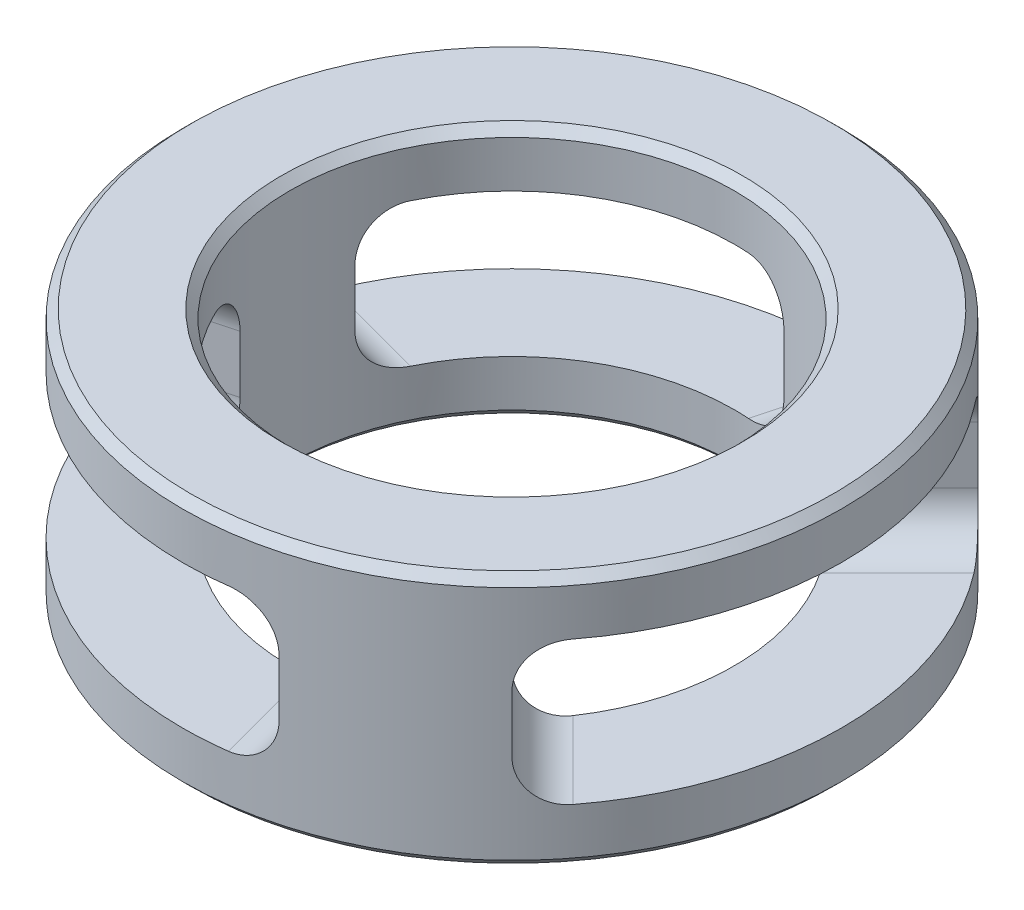
from build123d import *

# Parameters (mm, degrees)
SKETCH1_R           = 11.5
SKETCH1_R_2         = 7.75
BOSS_EXTRUDE1_DEPTH = 4.42
CUT_EXTRUDE1_DEPTH  = 2.5
FILLET1_R           = 1.5
CHAMFER1_SIZE       = 0.3


with BuildPart() as part:
    # Sketch1 → Boss-Extrude1 (new, symmetric)
    with BuildSketch(Plane(origin=(0, 0, 0), x_dir=(1, 0, 0), z_dir=(0, 1, 0))):
        with Locations(Location((0, 0, 0), (0, 0, 270))):
            Circle(SKETCH1_R)
        with Locations(Location((0, 0, 0), (0, 0, 270))):
            Circle(SKETCH1_R_2, mode=Mode.SUBTRACT)
    extrude(amount=BOSS_EXTRUDE1_DEPTH, both=True)

    # Sketch2 → Cut-Extrude1 (cut, symmetric)
    with BuildSketch(Plane(origin=(0, 0, 0), x_dir=(1, 0, 0), z_dir=(0, 1, 0))):
        with BuildLine():
            Line((4.772970773, 4.772970773), (8.838834765, 8.838834765))
            ThreePointArc((8.838834765, 8.838834765), (12.5, 0), (8.838834765, -8.838834765))
            Line((8.838834765, -8.838834765), (4.772970773, -4.772970773))
            ThreePointArc((4.772970773, -4.772970773), (6.75, 0), (4.772970773, 4.772970773))
        make_face()
        with BuildLine():
            Line((1.747028554, -6.519999327), (3.235238064, -12.074072829))
            ThreePointArc((3.235238064, -12.074072829), (-6.25, -10.825317547), (-12.074072829, -3.235238064))
            Line((-12.074072829, -3.235238064), (-6.519999327, -1.747028554))
            ThreePointArc((-6.519999327, -1.747028554), (-3.375, -5.845671476), (1.747028554, -6.519999327))
        make_face()
        with BuildLine():
            Line((-6.519999327, 1.747028554), (-12.074072829, 3.235238064))
            ThreePointArc((-12.074072829, 3.235238064), (-6.25, 10.825317547), (3.235238064, 12.074072829))
            Line((3.235238064, 12.074072829), (1.747028554, 6.519999327))
            ThreePointArc((1.747028554, 6.519999327), (-3.375, 5.845671476), (-6.519999327, 1.747028554))
        make_face()
    extrude(amount=CUT_EXTRUDE1_DEPTH, both=True, mode=Mode.SUBTRACT)

    # Fillet1
    fillet1_edges = [part.edges().sort_by_distance(p)[0] for p in [
        (6.805902769, -2.5, -6.805902769),
        (6.805902769, -2.5, 6.805902769),
        (6.805902769, 2.5, -6.805902769),
        (6.805902769, 2.5, 6.805902769),
        (2.491133309, -2.5, 9.297036078),
        (-9.297036078, -2.5, 2.491133309),
        (2.491133309, 2.5, 9.297036078),
        (-9.297036078, 2.5, 2.491133309),
        (-9.297036078, -2.5, -2.491133309),
        (2.491133309, -2.5, -9.297036078),
        (-9.297036078, 2.5, -2.491133309),
        (2.491133309, 2.5, -9.297036078),
    ]]
    fillet(fillet1_edges, radius=FILLET1_R)

    # Chamfer1
    chamfer1_edges = [part.edges().sort_by_distance(p)[0] for p in [
        (0, -4.42, -11.5),
        (0, 4.42, -11.5),
        (0, -4.42, -7.75),
        (0, 4.42, -7.75),
    ]]
    chamfer(chamfer1_edges, length=CHAMFER1_SIZE)


solid = part.part
